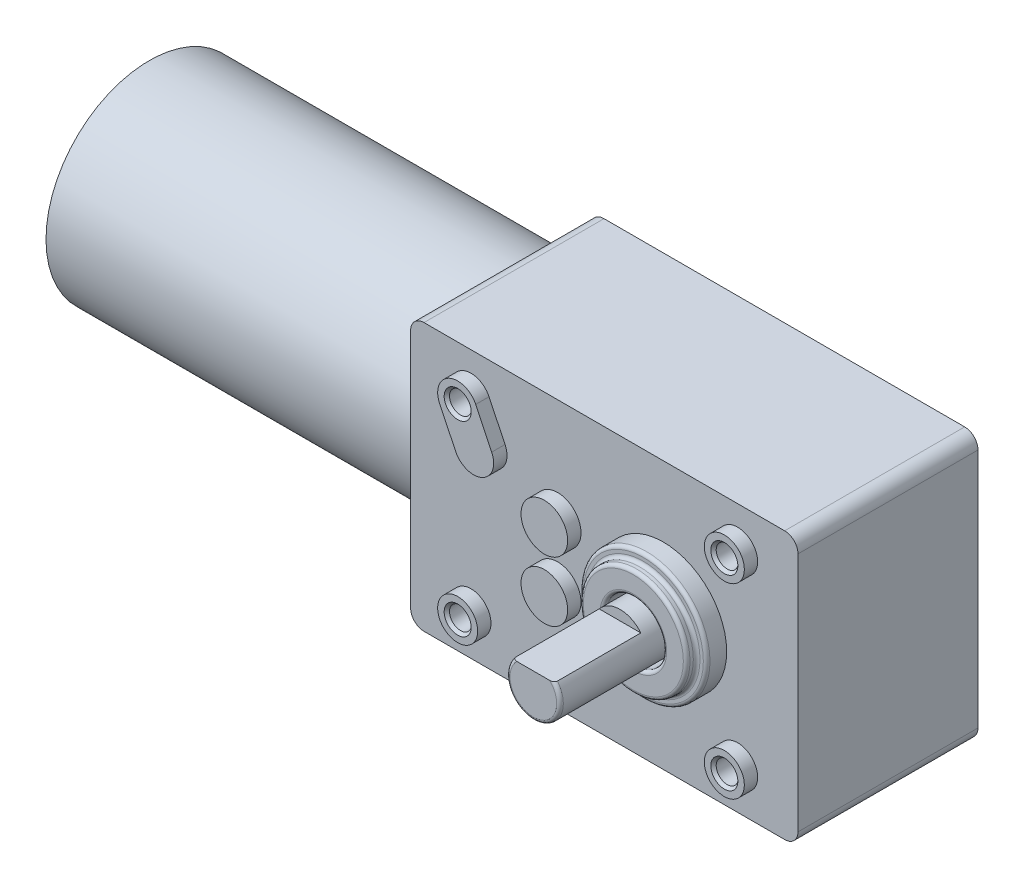
from build123d import *

# Parameters (mm, degrees)
SALIENTE_EXTRUIR1_DEPTH            = 18
SALIENTE_EXTRUIR1_DEPTH_BACK       = 9
SALIENTE_EXTRUIR2_DEPTH            = 20
SALIENTE_EXTRUIR2_DEPTH_BACK       = 11
CROQUIS3_3_R                       = 3
CROQUIS3_3_R_2                     = 3.5
CORTAR_EXTRUIR1_DEPTH              = 13
TALADRO_ROSCADO_M4X0_71_AT_2_COUNT = 2
TALADRO_ROSCADO_M4X0_71_AT_2_PITCH = 40
TALADRO_ROSCADO_M4X0_71_AT_3_COUNT = 2
TALADRO_ROSCADO_M4X0_71_AT_3_PITCH = 48.826222463
TALADRO_ROSCADO_M4X0_71_AT_4_COUNT = 2
TALADRO_ROSCADO_M4X0_71_AT_4_PITCH = 28


with BuildPart() as part:
    # Croquis2 → Revolución1 (revolve)
    with BuildSketch(Plane.XY):
        Polygon((-57.2, 6), (-57.2, 15.5), (0, 15.5), (0, 0), (-57.2, 0), (-60.2, 0), (-60.2, 6), align=None)
    revolve(axis=Axis((0, 0, 0), (-1, 0, 0)))


with BuildPart() as body_2:
    # Croquis3 → Saliente-Extruir1 (new, two sides: drawn at the far end of the back side and taken through both)
    with BuildSketch(Plane.XY.offset(-SALIENTE_EXTRUIR1_DEPTH_BACK)):
        with BuildLine():
            Line((2, 20.055), (56.1, 20.055))
            ThreePointArc((56.1, 20.055), (57.514213562, 19.469213562), (58.1, 18.055))
            Line((58.1, 18.055), (58.1, -18.055))
            ThreePointArc((58.1, -18.055), (57.514213562, -19.469213562), (56.1, -20.055))
            Line((56.1, -20.055), (2, -20.055))
            ThreePointArc((2, -20.055), (0.585786438, -19.469213562), (0, -18.055))
            Line((0, -18.055), (0, 18.055))
            ThreePointArc((0, 18.055), (0.585786438, 19.469213562), (2, 20.055))
        make_face()
    extrude(amount=SALIENTE_EXTRUIR1_DEPTH + SALIENTE_EXTRUIR1_DEPTH_BACK)

    # Croquis3<3> → Saliente-Extruir2 (add, two sides: drawn at the far end of the back side and taken through both)
    with BuildSketch(Plane.XY.offset(-SALIENTE_EXTRUIR2_DEPTH_BACK)):
        with BuildLine():
            Line((14.154569172, 10.298193203), (11.754569172, 15.298193203))
            ThreePointArc((11.754569172, 15.298193203), (7.751806797, 16.704569172), (6.345430828, 12.701806797))
            Line((6.345430828, 12.701806797), (8.745430828, 7.701806797))
            ThreePointArc((8.745430828, 7.701806797), (12.748193203, 6.295430828), (14.154569172, 10.298193203))
        make_face()
        with Locations((49.05, 14)):
            Circle(CROQUIS3_3_R)
        with Locations((49.05, -14)):
            Circle(CROQUIS3_3_R)
        with Locations((9.05, -14)):
            Circle(CROQUIS3_3_R)
        with Locations((22.05, 4.5)):
            Circle(CROQUIS3_3_R_2)
        with Locations((22.05, -4.5)):
            Circle(CROQUIS3_3_R_2)
    extrude(amount=SALIENTE_EXTRUIR2_DEPTH + SALIENTE_EXTRUIR2_DEPTH_BACK)

    # Croquis4 → Revolución2 (revolve)
    with BuildSketch(Plane.ZY.offset(-37.9)):
        with BuildLine():
            Line((37.5, 0), (37.5, 3.5))
            ThreePointArc((37.5, 3.5), (37.353553391, 3.853553391), (37, 4))
            Line((37, 4), (18, 4))
            Line((18, 4), (18, 4.5))
            Line((18, 4.5), (22, 4.5))
            ThreePointArc((22, 4.5), (22.353553391, 4.646446609), (22.5, 5))
            Line((22.5, 5), (22.5, 7.5))
            ThreePointArc((22.5, 7.5), (22.353553391, 7.853553391), (22, 8))
            Line((22, 8), (21.5, 8))
            ThreePointArc((21.5, 8), (21.146446609, 8.146446609), (21, 8.5))
            Line((21, 8.5), (21, 9))
            ThreePointArc((21, 9), (20.853553391, 9.353553391), (20.5, 9.5))
            Line((20.5, 9.5), (-11.5, 9.5))
            ThreePointArc((-11.5, 9.5), (-11.853553391, 9.353553391), (-12, 9))
            Line((-12, 9), (-12, 8.5))
            ThreePointArc((-12, 8.5), (-12.146446609, 8.146446609), (-12.5, 8))
            Line((-12.5, 8), (-13, 8))
            ThreePointArc((-13, 8), (-13.353553391, 7.853553391), (-13.5, 7.5))
            Line((-13.5, 7.5), (-13.5, 4.25))
            ThreePointArc((-13.5, 4.25), (-13.353553391, 3.896446609), (-13, 3.75))
            Line((-13, 3.75), (-9, 3.75))
            Line((-9, 3.75), (-9, 0))
            Line((-9, 0), (18, 0))
            Line((18, 0), (37.5, 0))
        make_face()
    revolve(axis=Axis((37.9, 0, 18), (0, 0, -1)))

    # Croquis5 → Cortar-Extruir1 (cut)
    with BuildSketch(Plane.XY.offset(37.5)):
        with BuildLine():
            Line((34.777501001, 2.5), (41.022498999, 2.5))
            ThreePointArc((41.022498999, 2.5), (37.9, 4), (34.777501001, 2.5))
        make_face()
    extrude(amount=-CORTAR_EXTRUIR1_DEPTH, mode=Mode.SUBTRACT)

    # Croquis7 → Taladro roscado M4x0.71 (revolve, cut)
    with BuildSketch(Plane(origin=(9.05, 14, 20), x_dir=(0, -1, 0), z_dir=(1, 0, 0))):
        Polygon((0, 0), (0, 8.491420021), (1.65, 7.5), (1.65, 0.431388153), (2.025, 0), align=None)
    taladro_roscado_m4x0_71 = revolve(axis=Axis((9.05, 14, 26.35), (0, 0, -1)), mode=Mode.SUBTRACT)

    # Taladro roscado M4x0.71 at 2: Taladro roscado M4x0.71 ×2
    with Locations(*[(i * TALADRO_ROSCADO_M4X0_71_AT_2_PITCH, 0, 0) for i in range(1, TALADRO_ROSCADO_M4X0_71_AT_2_COUNT)]):
        add(taladro_roscado_m4x0_71, mode=Mode.SUBTRACT)

    # Taladro roscado M4x0.71 at 3: Taladro roscado M4x0.71 ×2
    with Locations(*[Vector(0.8192319205190406, -0.5734623443633283, 0) * (i * TALADRO_ROSCADO_M4X0_71_AT_3_PITCH) for i in range(1, TALADRO_ROSCADO_M4X0_71_AT_3_COUNT)]):
        add(taladro_roscado_m4x0_71, mode=Mode.SUBTRACT)

    # Taladro roscado M4x0.71 at 4: Taladro roscado M4x0.71 ×2
    with Locations(*[(0, -i * TALADRO_ROSCADO_M4X0_71_AT_4_PITCH, 0) for i in range(1, TALADRO_ROSCADO_M4X0_71_AT_4_COUNT)]):
        add(taladro_roscado_m4x0_71, mode=Mode.SUBTRACT)


solid = Compound([part.part, body_2.part])
